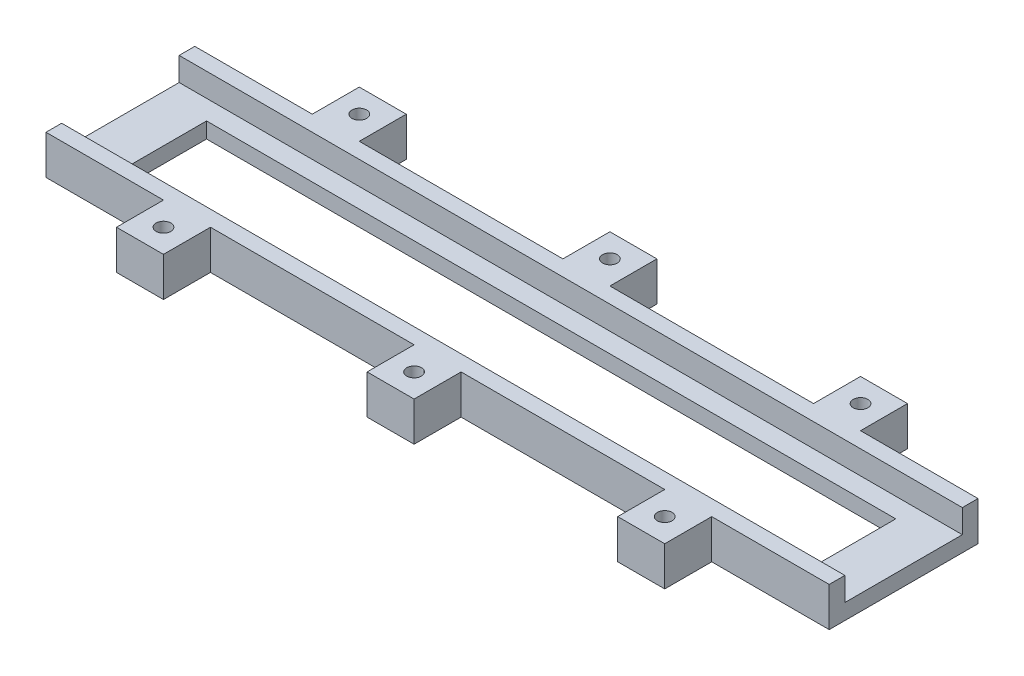
from build123d import *

# Parameters (mm, degrees)
SKETCH1_W           = 160
SKETCH1_H           = 30.4
BOSS_EXTRUDE1_DEPTH = 3.2
SKETCH2_W           = 160
SKETCH2_H           = 3.2
BOSS_EXTRUDE2_DEPTH = 4.8
SKETCH3_W           = 140.8
SKETCH3_H           = 16
CUT_EXTRUDE1_DEPTH  = 163.933115112
SKETCH4_W           = 9.6
SKETCH4_H           = 9.6
SKETCH4_R           = 1.5
BOSS_EXTRUDE3_DEPTH = 8


with BuildPart() as part:
    # Sketch1 → Boss-Extrude1 (new body)
    with BuildSketch(Plane(origin=(0, 0, 0), x_dir=(1, 0, 0), z_dir=(0, 1, 0))):
        with Locations((80, -15.2)):
            Rectangle(SKETCH1_W, SKETCH1_H)
    extrude(amount=BOSS_EXTRUDE1_DEPTH)

    # Sketch2 → Boss-Extrude2 (add)
    with BuildSketch(Plane(origin=(0, 3.2, 0), x_dir=(1, 0, 0), z_dir=(0, 1, 0))):
        with Locations((80, -28.8)):
            Rectangle(SKETCH2_W, SKETCH2_H)
        with Locations((80, -1.6)):
            Rectangle(SKETCH2_W, SKETCH2_H)
    extrude(amount=BOSS_EXTRUDE2_DEPTH)

    # Sketch3 → Cut-Extrude1 (cut, through all)
    with BuildSketch(Plane(origin=(0, 3.2, 0), x_dir=(1, 0, 0), z_dir=(0, 1, 0))):
        with Locations((80, -15.2)):
            Rectangle(SKETCH3_W, SKETCH3_H)
    extrude(amount=-CUT_EXTRUDE1_DEPTH, mode=Mode.SUBTRACT)

    # Sketch4 → Boss-Extrude3 (add)
    # profile 1 of 6: a face of its own
    with BuildSketch(Plane(origin=(0, 8, 0), x_dir=(1, 0, 0), z_dir=(0, 1, 0))):
        with Locations((28.8, -35.2)):
            Rectangle(SKETCH4_W, SKETCH4_H)
        with Locations(Location((28.8, -35.2, 0), (0, 0, 270))):
            Circle(SKETCH4_R, mode=Mode.SUBTRACT)
    # profile 2 of 6: a face of its own
    with BuildSketch(Plane(origin=(0, 8, 0), x_dir=(1, 0, 0), z_dir=(0, 1, 0))):
        with Locations((80, -35.2)):
            Rectangle(SKETCH4_W, SKETCH4_H)
        with Locations(Location((80, -35.2, 0), (0, 0, 270))):
            Circle(SKETCH4_R, mode=Mode.SUBTRACT)
    # profile 3 of 6: a face of its own
    with BuildSketch(Plane(origin=(0, 8, 0), x_dir=(1, 0, 0), z_dir=(0, 1, 0))):
        with Locations((131.2, -35.2)):
            Rectangle(SKETCH4_W, SKETCH4_H)
        with Locations(Location((131.2, -35.2, 0), (0, 0, 270))):
            Circle(SKETCH4_R, mode=Mode.SUBTRACT)
    # profile 4 of 6: a face of its own
    with BuildSketch(Plane(origin=(0, 8, 0), x_dir=(1, 0, 0), z_dir=(0, 1, 0))):
        with Locations((80, 4.8)):
            Rectangle(SKETCH4_W, SKETCH4_H)
        with Locations(Location((80, 4.8, 0), (0, 0, 270))):
            Circle(SKETCH4_R, mode=Mode.SUBTRACT)
    # profile 5 of 6: a face of its own
    with BuildSketch(Plane(origin=(0, 8, 0), x_dir=(1, 0, 0), z_dir=(0, 1, 0))):
        with Locations((131.2, 4.8)):
            Rectangle(SKETCH4_W, SKETCH4_H)
        with Locations(Location((131.2, 4.8, 0), (0, 0, 270))):
            Circle(SKETCH4_R, mode=Mode.SUBTRACT)
    # profile 6 of 6: a face of its own
    with BuildSketch(Plane(origin=(0, 8, 0), x_dir=(1, 0, 0), z_dir=(0, 1, 0))):
        with Locations((28.8, 4.8)):
            Rectangle(SKETCH4_W, SKETCH4_H)
        with Locations(Location((28.8, 4.8, 0), (0, 0, 270))):
            Circle(SKETCH4_R, mode=Mode.SUBTRACT)
    extrude(amount=-BOSS_EXTRUDE3_DEPTH)


solid = part.part
